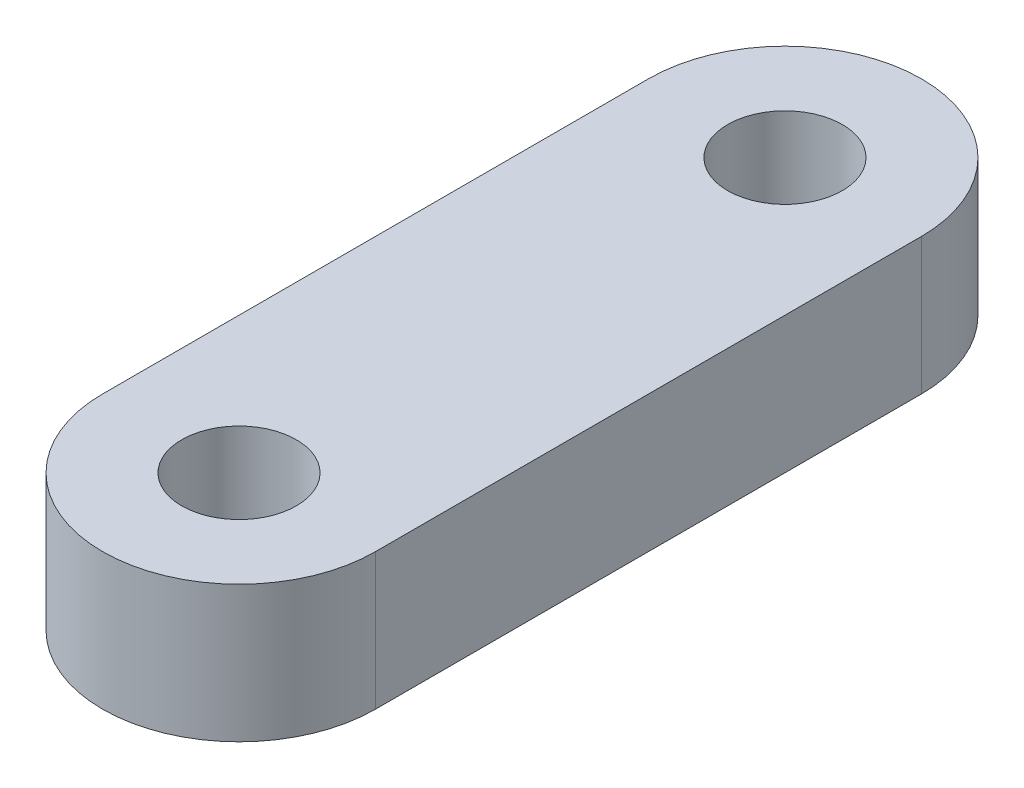
from build123d import *

# Parameters (mm, degrees)
SKETCH_1_R      = 2.1
EXTRUDE_1_DEPTH = 5


with BuildPart() as part:
    # ｽｹｯﾁ1 → ﾎﾞｽ - 押し出し1 (new body)
    with BuildSketch(Plane(origin=(0, 0, 0), x_dir=(1, 0, 0), z_dir=(0, 1, 0))):
        with BuildLine():
            Line((-5, -10), (-5, 10))
            ThreePointArc((-5, 10), (0, 15), (5, 10))
            Line((5, 10), (5, -10))
            ThreePointArc((5, -10), (0, -15), (-5, -10))
        make_face()
        with Locations(Location((0, 10, 0), (0, 0, 270))):
            Circle(SKETCH_1_R, mode=Mode.SUBTRACT)
        with Locations(Location((0, -10, 0), (0, 0, 270))):
            Circle(SKETCH_1_R, mode=Mode.SUBTRACT)
    extrude(amount=EXTRUDE_1_DEPTH)


solid = part.part
